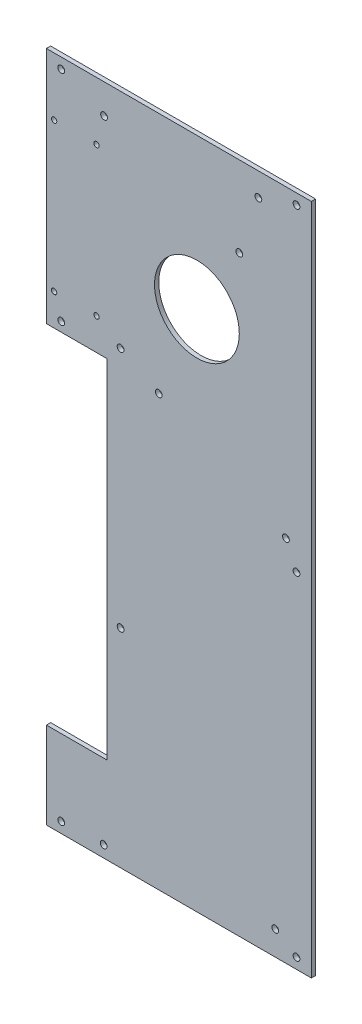
from build123d import *

# Parameters (mm, degrees)
SKETCH1_R           = 1.6
SKETCH1_R_2         = 20
SKETCH1_R_3         = 1.25
BOSS_EXTRUDE1_DEPTH = 2


with BuildPart() as part:
    # Sketch1 → Boss-Extrude1 (new body)
    with BuildSketch(Plane(origin=(0, 0, 0), x_dir=(0, 1, 0), z_dir=(0, 0, 1))):
        Polygon((-98, 35), (-98, -90), (219.3, -90), (219.3, 35), (106.85, 35), (106.85, 6.35), (-57.15, 6.35), (-57.15, 35), align=None)
        with Locations(Location((205.3, 7.8, 0), (0, 0, 270))):
            Circle(SKETCH1_R, mode=Mode.SUBTRACT)
        with Locations(Location((-92.5, 8, 0), (0, 0, 270))):
            Circle(SKETCH1_R, mode=Mode.SUBTRACT)
        with Locations(Location((-93, 28, 0), (0, 0, 270))):
            Circle(SKETCH1_R, mode=Mode.SUBTRACT)
        with Locations(Location((114.3, 0, 0), (0, 0, 270))):
            Circle(SKETCH1_R, mode=Mode.SUBTRACT)
        with Locations(Location((-93, -83, 0), (0, 0, 270))):
            Circle(SKETCH1_R, mode=Mode.SUBTRACT)
        with Locations(Location((-86.5, -73, 0), (0, 0, 270))):
            Circle(SKETCH1_R, mode=Mode.SUBTRACT)
        with Locations(Location((64.3, -83, 0), (0, 0, 270))):
            Circle(SKETCH1_R, mode=Mode.SUBTRACT)
        with Locations(Location((75.7, -78, 0), (0, 0, 270))):
            Circle(SKETCH1_R, mode=Mode.SUBTRACT)
        with Locations(Location((214.3, -83, 0), (0, 0, 270))):
            Circle(SKETCH1_R, mode=Mode.SUBTRACT)
        with Locations(Location((208.3, -65, 0), (0, 0, 270))):
            Circle(SKETCH1_R, mode=Mode.SUBTRACT)
        with Locations(Location((181.3, -56, 0), (0, 0, 270))):
            Circle(SKETCH1_R, mode=Mode.SUBTRACT)
        with Locations(Location((148.3, -36, 0), (0, 0, 270))):
            Circle(SKETCH1_R_2, mode=Mode.SUBTRACT)
        with Locations(Location((0, 0, 0), (0, 0, 270))):
            Circle(SKETCH1_R, mode=Mode.SUBTRACT)
        with Locations(Location((104.8, -18, 0), (0, 0, 270))):
            Circle(SKETCH1_R, mode=Mode.SUBTRACT)
        with Locations(Location((191.85, 31.35, 0), (0, 0, 270))):
            Circle(SKETCH1_R_3, mode=Mode.SUBTRACT)
        with Locations(Location((121.85, 11.35, 0), (0, 0, 270))):
            Circle(SKETCH1_R_3, mode=Mode.SUBTRACT)
        with Locations(Location((111.3, 28, 0), (0, 0, 270))):
            Circle(SKETCH1_R, mode=Mode.SUBTRACT)
        with Locations(Location((121.85, 31.35, 0), (0, 0, 270))):
            Circle(SKETCH1_R_3, mode=Mode.SUBTRACT)
        with Locations(Location((191.85, 11.35, 0), (0, 0, 270))):
            Circle(SKETCH1_R_3, mode=Mode.SUBTRACT)
        with Locations(Location((214.3, 28, 0), (0, 0, 270))):
            Circle(SKETCH1_R, mode=Mode.SUBTRACT)
    extrude(amount=-BOSS_EXTRUDE1_DEPTH)


solid = part.part
